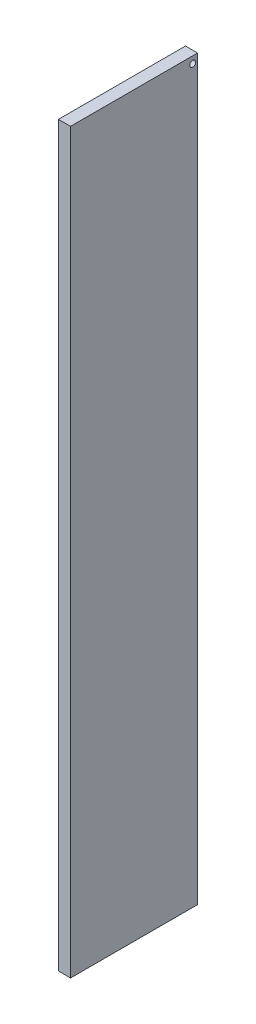
from build123d import *

# Parameters (mm, degrees)
SKETCH1_W           = 66.675
SKETCH1_H           = 387.096
BOSS_EXTRUDE1_DEPTH = 6.35
CUT_EXTRUDE1_REACH  = 198.501
SKETCH2_R           = 1.5875


with BuildPart() as part:
    # Sketch1 → Boss-Extrude1 (new body)
    with BuildSketch(Plane(origin=(0, 0, 0), x_dir=(0, 0, -1), z_dir=(1, 0, 0))):
        Rectangle(SKETCH1_W, SKETCH1_H)
    extrude(amount=BOSS_EXTRUDE1_DEPTH)

    # Sketch2 → Cut-Extrude1 (cut, up to next)
    with BuildSketch(Plane(origin=(6.35, 0, 0), x_dir=(0, 0, -1), z_dir=(1, 0, 0)), mode=Mode.PRIVATE) as cut_extrude1_sk1:
        with Locations((30.816663564, 189.929324987)):
            Circle(SKETCH2_R)
    cut_extrude1_tool1 = extrude(cut_extrude1_sk1.sketch, amount=-CUT_EXTRUDE1_REACH, mode=Mode.PRIVATE) & part.part
    add(cut_extrude1_tool1.solids().sort_by_distance((6.35, 189.929325, -30.816664))[0], mode=Mode.SUBTRACT)


solid = part.part
